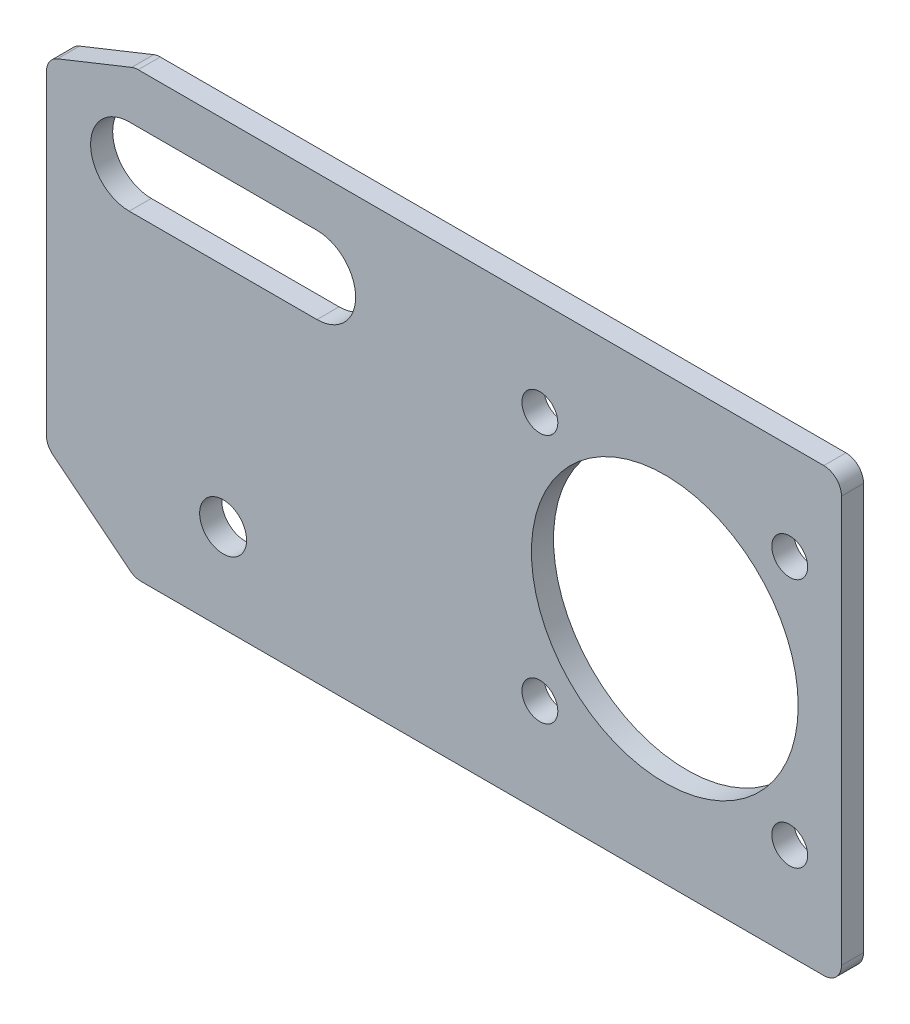
from build123d import *

# Parameters (mm, degrees)
BOSS_EXTRUDE1_DEPTH              = 3.175
SKETCH2_R                        = 19.177
CUT_EXTRUDE1_DEPTH               = 3.175
SKETCH3_R                        = 3.3734375
CUT_EXTRUDE2_DEPTH               = 3.175
CUT_EXTRUDE3_DEPTH               = 120.85362166
FILLET1_R                        = 2.54
F_13_64_0_20313_DIAMETER_HOLE1_D = 5.159502


with BuildPart() as part:
    # Sketch1 → Boss-Extrude1 (new body)
    with BuildSketch(Plane.XY):
        Polygon((-12.7, 58.42), (0, 63.5), (101.6, 63.5), (101.6, 0), (0, 0), (-12.7, 10.16), align=None)
    extrude(amount=BOSS_EXTRUDE1_DEPTH)

    # Sketch2 → Cut-Extrude1 (cut)
    with BuildSketch(Plane.XY.offset(3.175)):
        with Locations((76.2, 31.75)):
            Circle(SKETCH2_R)
    extrude(amount=-CUT_EXTRUDE1_DEPTH, mode=Mode.SUBTRACT)

    # Sketch3 → Cut-Extrude2 (cut)
    with BuildSketch(Plane.XY.offset(3.175)):
        with Locations((12.7, 12.7)):
            Circle(SKETCH3_R)
    extrude(amount=-CUT_EXTRUDE2_DEPTH, mode=Mode.SUBTRACT)

    # Sketch4 → Cut-Extrude3 (cut, through all)
    with BuildSketch(Plane.XY.offset(3.175)):
        with BuildLine():
            Line((-0.79375, 56.35625), (26.19375, 56.35625))
            ThreePointArc((26.19375, 56.35625), (31.75, 50.8), (26.19375, 45.24375))
            Line((26.19375, 45.24375), (-0.79375, 45.24375))
            ThreePointArc((-0.79375, 45.24375), (-6.35, 50.8), (-0.79375, 56.35625))
        make_face()
    extrude(amount=-CUT_EXTRUDE3_DEPTH, mode=Mode.SUBTRACT)

    # Fillet1
    fillet1_edges = [part.edges().sort_by_distance(p)[0] for p in [
        (-12.7, 10.16, 1.5875),
        (-12.7, 58.42, 1.5875),
        (0, 63.5, 1.5875),
        (101.6, 63.5, 1.5875),
        (101.6, 0, 1.5875),
        (0, 0, 1.5875),
    ]]
    fillet(fillet1_edges, radius=FILLET1_R)

    # 13/64 (0.20313) Diameter Hole1 (through all)
    with Locations(Plane.XY.offset(3.175)):
        with Locations((58.239487758, 49.710512242), (94.160512242, 49.710512242), (94.160512242, 13.789487758), (58.239487758, 13.789487758)):
            Hole(F_13_64_0_20313_DIAMETER_HOLE1_D / 2)


solid = part.part
